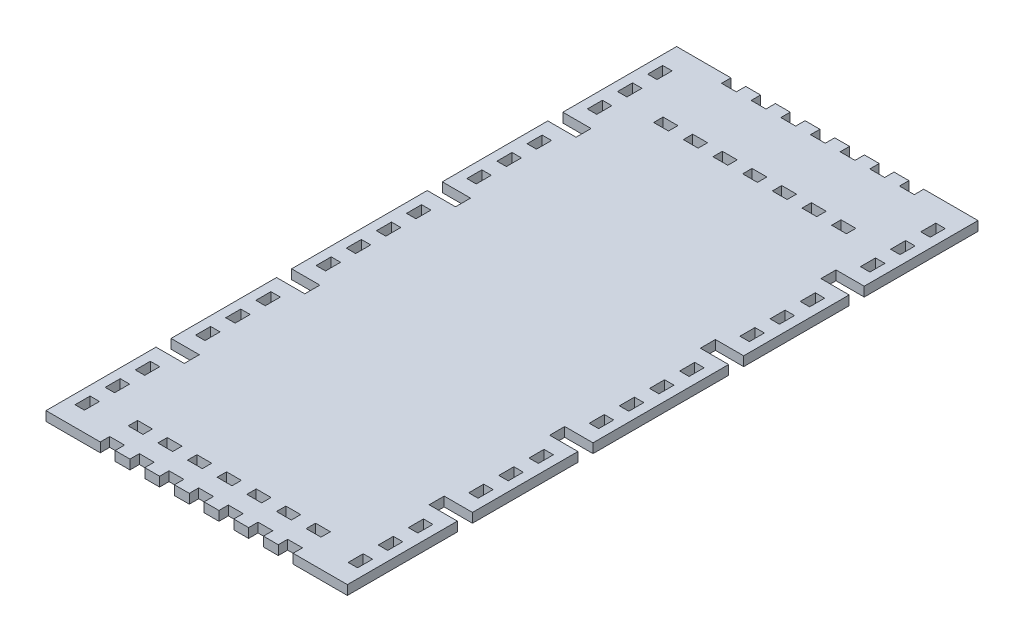
from build123d import *

# Parameters (mm, degrees)
SKETCH2_W           = 3.175
SKETCH2_H           = 5.08
SKETCH2_W_2         = 5
SKETCH2_H_2         = 3.175
BOSS_EXTRUDE1_DEPTH = 3.175


with BuildPart() as part:
    # Sketch2 → Boss-Extrude1 (new body)
    with BuildSketch(Plane(origin=(0, 0, 0), x_dir=(1, 0, 0), z_dir=(0, 1, 0))):
        Polygon((-64.899210769, -170.113420965), (-46.599210769, -170.113420965), (-46.599210769, -166.938420965), (-41.599210769, -166.938420965), (-41.599210769, -170.113420965), (-36.599210769, -170.113420965), (-36.599210769, -166.938420965), (-31.599210769, -166.938420965), (-31.599210769, -170.113420965), (-26.599210769, -170.113420965), (-26.599210769, -166.938420965), (-21.599210769, -166.938420965), (-21.599210769, -170.113420965), (-16.599210769, -170.113420965), (-16.599210769, -166.938420965), (-11.599210769, -166.938420965), (-11.599210769, -170.113420965), (-6.599210769, -170.113420965), (-6.599210769, -166.938420965), (-1.599210769, -166.938420965), (-1.599210769, -170.113420965), (3.400789231, -170.113420965), (3.400789231, -166.938420965), (8.400789231, -166.938420965), (8.400789231, -170.113420965), (13.400789231, -170.113420965), (13.400789231, -166.938420965), (18.400789231, -166.938420965), (18.400789231, -170.113420965), (36.700789231, -170.113420965), (36.700789231, -133.029420965), (27.175789231, -133.029420965), (27.175789231, -127.949420965), (36.700789231, -127.949420965), (36.700789231, -92.389420965), (27.175789231, -92.389420965), (27.175789231, -87.309420965), (36.700789231, -87.309420965), (36.700789231, -41.589420965), (27.175789231, -41.589420965), (27.175789231, -36.509420965), (36.700789231, -36.509420965), (36.700789231, -0.949420965), (27.175789231, -0.949420965), (27.175789231, 4.130579035), (36.700789231, 4.130579035), (36.700789231, 42.484579035), (18.400789231, 42.484579035), (18.400789231, 39.309579035), (13.400789231, 39.309579035), (13.400789231, 42.484579035), (8.400789231, 42.484579035), (8.400789231, 39.309579035), (3.400789231, 39.309579035), (3.400789231, 42.484579035), (-1.599210769, 42.484579035), (-1.599210769, 39.309579035), (-6.599210769, 39.309579035), (-6.599210769, 42.484579035), (-11.599210769, 42.484579035), (-11.599210769, 39.309579035), (-16.599210769, 39.309579035), (-16.599210769, 42.484579035), (-21.599210769, 42.484579035), (-21.599210769, 39.309579035), (-26.599210769, 39.309579035), (-26.599210769, 42.484579035), (-31.599210769, 42.484579035), (-31.599210769, 39.309579035), (-36.599210769, 39.309579035), (-36.599210769, 42.484579035), (-41.599210769, 42.484579035), (-41.599210769, 39.309579035), (-46.599210769, 39.309579035), (-46.599210769, 42.484579035), (-64.899210769, 42.484579035), (-64.899210769, 4.130579035), (-55.374210769, 4.130579035), (-55.374210769, -0.949420965), (-64.899210769, -0.949420965), (-64.899210769, -36.509420965), (-55.374210769, -36.509420965), (-55.374210769, -41.589420965), (-64.899210769, -41.589420965), (-64.899210769, -87.309420965), (-55.374210769, -87.309420965), (-55.374210769, -92.389420965), (-64.899210769, -92.389420965), (-64.899210769, -127.949420965), (-55.374210769, -127.949420965), (-55.374210769, -133.029420965), (-64.899210769, -133.029420965), align=None)
        with Locations((-60.136710769, -160.969420965)):
            Rectangle(SKETCH2_W, SKETCH2_H, mode=Mode.SUBTRACT)
        with Locations((31.938289231, -160.969420965)):
            Rectangle(SKETCH2_W, SKETCH2_H, mode=Mode.SUBTRACT)
        with Locations((-60.136710769, -150.809420965)):
            Rectangle(SKETCH2_W, SKETCH2_H, mode=Mode.SUBTRACT)
        with Locations((-60.136710769, -140.649420965)):
            Rectangle(SKETCH2_W, SKETCH2_H, mode=Mode.SUBTRACT)
        with Locations((-60.136710769, -120.329420965)):
            Rectangle(SKETCH2_W, SKETCH2_H, mode=Mode.SUBTRACT)
        with Locations((-60.136710769, -110.169420965)):
            Rectangle(SKETCH2_W, SKETCH2_H, mode=Mode.SUBTRACT)
        with Locations((-60.136710769, -100.009420965)):
            Rectangle(SKETCH2_W, SKETCH2_H, mode=Mode.SUBTRACT)
        with Locations((-60.136710769, -79.689420965)):
            Rectangle(SKETCH2_W, SKETCH2_H, mode=Mode.SUBTRACT)
        with Locations((-60.136710769, -69.529420965)):
            Rectangle(SKETCH2_W, SKETCH2_H, mode=Mode.SUBTRACT)
        with Locations((-60.136710769, -59.369420965)):
            Rectangle(SKETCH2_W, SKETCH2_H, mode=Mode.SUBTRACT)
        with Locations((-60.136710769, -49.209420965)):
            Rectangle(SKETCH2_W, SKETCH2_H, mode=Mode.SUBTRACT)
        with Locations((-60.136710769, -28.889420965)):
            Rectangle(SKETCH2_W, SKETCH2_H, mode=Mode.SUBTRACT)
        with Locations((-60.136710769, -18.729420965)):
            Rectangle(SKETCH2_W, SKETCH2_H, mode=Mode.SUBTRACT)
        with Locations((-60.136710769, -8.569420965)):
            Rectangle(SKETCH2_W, SKETCH2_H, mode=Mode.SUBTRACT)
        with Locations((-60.136710769, 11.750579035)):
            Rectangle(SKETCH2_W, SKETCH2_H, mode=Mode.SUBTRACT)
        with Locations((-60.136710769, 21.910579035)):
            Rectangle(SKETCH2_W, SKETCH2_H, mode=Mode.SUBTRACT)
        with Locations((-60.136710769, 32.070579035)):
            Rectangle(SKETCH2_W, SKETCH2_H, mode=Mode.SUBTRACT)
        with Locations((31.938289231, 32.070579035)):
            Rectangle(SKETCH2_W, SKETCH2_H, mode=Mode.SUBTRACT)
        with Locations((31.938289231, 21.910579035)):
            Rectangle(SKETCH2_W, SKETCH2_H, mode=Mode.SUBTRACT)
        with Locations((31.938289231, 11.750579035)):
            Rectangle(SKETCH2_W, SKETCH2_H, mode=Mode.SUBTRACT)
        with Locations((31.938289231, -8.569420965)):
            Rectangle(SKETCH2_W, SKETCH2_H, mode=Mode.SUBTRACT)
        with Locations((31.938289231, -18.729420965)):
            Rectangle(SKETCH2_W, SKETCH2_H, mode=Mode.SUBTRACT)
        with Locations((31.938289231, -28.889420965)):
            Rectangle(SKETCH2_W, SKETCH2_H, mode=Mode.SUBTRACT)
        with Locations((31.938289231, -49.209420965)):
            Rectangle(SKETCH2_W, SKETCH2_H, mode=Mode.SUBTRACT)
        with Locations((31.938289231, -59.369420965)):
            Rectangle(SKETCH2_W, SKETCH2_H, mode=Mode.SUBTRACT)
        with Locations((31.938289231, -69.529420965)):
            Rectangle(SKETCH2_W, SKETCH2_H, mode=Mode.SUBTRACT)
        with Locations((31.938289231, -79.689420965)):
            Rectangle(SKETCH2_W, SKETCH2_H, mode=Mode.SUBTRACT)
        with Locations((31.938289231, -100.009420965)):
            Rectangle(SKETCH2_W, SKETCH2_H, mode=Mode.SUBTRACT)
        with Locations((31.938289231, -110.169420965)):
            Rectangle(SKETCH2_W, SKETCH2_H, mode=Mode.SUBTRACT)
        with Locations((31.938289231, -120.329420965)):
            Rectangle(SKETCH2_W, SKETCH2_H, mode=Mode.SUBTRACT)
        with Locations((31.938289231, -140.649420965)):
            Rectangle(SKETCH2_W, SKETCH2_H, mode=Mode.SUBTRACT)
        with Locations((31.938289231, -150.809420965)):
            Rectangle(SKETCH2_W, SKETCH2_H, mode=Mode.SUBTRACT)
        with Locations((-44.099210769, 18.023079063)):
            Rectangle(SKETCH2_W_2, SKETCH2_H_2, mode=Mode.SUBTRACT)
        with Locations((-34.099210769, 18.023079063)):
            Rectangle(SKETCH2_W_2, SKETCH2_H_2, mode=Mode.SUBTRACT)
        with Locations((-24.099210769, 18.023079063)):
            Rectangle(SKETCH2_W_2, SKETCH2_H_2, mode=Mode.SUBTRACT)
        with Locations((-14.099210769, 18.023079063)):
            Rectangle(SKETCH2_W_2, SKETCH2_H_2, mode=Mode.SUBTRACT)
        with Locations((-4.099210769, 18.023079063)):
            Rectangle(SKETCH2_W_2, SKETCH2_H_2, mode=Mode.SUBTRACT)
        with Locations((5.900789231, 18.023079063)):
            Rectangle(SKETCH2_W_2, SKETCH2_H_2, mode=Mode.SUBTRACT)
        with Locations((15.900789231, 18.023079063)):
            Rectangle(SKETCH2_W_2, SKETCH2_H_2, mode=Mode.SUBTRACT)
        with Locations((15.900789231, -159.127920965)):
            Rectangle(SKETCH2_W_2, SKETCH2_H_2, mode=Mode.SUBTRACT)
        with Locations((5.900789231, -159.127920965)):
            Rectangle(SKETCH2_W_2, SKETCH2_H_2, mode=Mode.SUBTRACT)
        with Locations((-4.099210769, -159.127920965)):
            Rectangle(SKETCH2_W_2, SKETCH2_H_2, mode=Mode.SUBTRACT)
        with Locations((-14.099210769, -159.127920965)):
            Rectangle(SKETCH2_W_2, SKETCH2_H_2, mode=Mode.SUBTRACT)
        with Locations((-24.099210769, -159.127920965)):
            Rectangle(SKETCH2_W_2, SKETCH2_H_2, mode=Mode.SUBTRACT)
        with Locations((-34.099210769, -159.127920965)):
            Rectangle(SKETCH2_W_2, SKETCH2_H_2, mode=Mode.SUBTRACT)
        with Locations((-44.099210769, -159.127920965)):
            Rectangle(SKETCH2_W_2, SKETCH2_H_2, mode=Mode.SUBTRACT)
    extrude(amount=BOSS_EXTRUDE1_DEPTH)


solid = part.part
